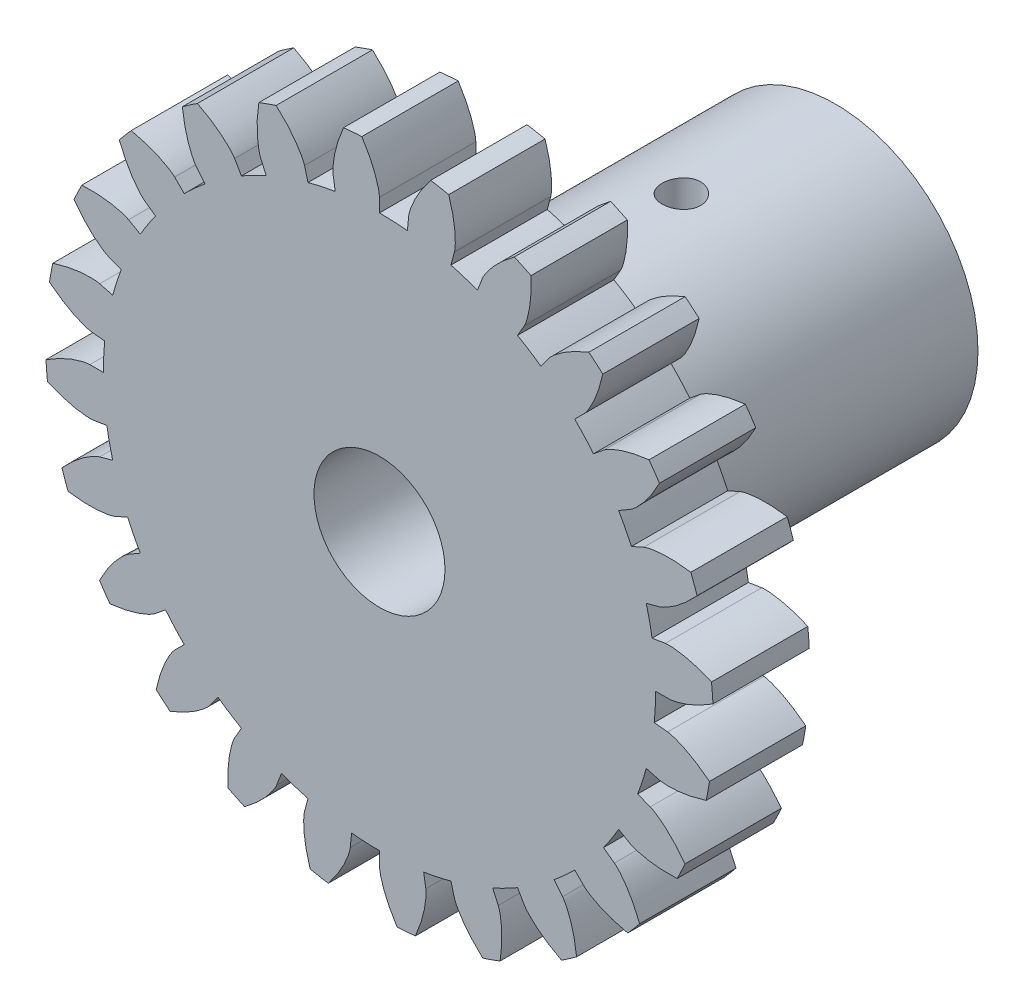
from build123d import *

# Parameters (mm, degrees)
SKETCH_3_R               = 26
EXTRUDE_2_DEPTH          = 7.5
CUT_EXTRUDE_2_DEPTH      = 38.526657192
PATTERN_CIRCULAR_1_COUNT = 24
MIRROR_1_COPY_1_DEPTH    = 38.526657192
MIRROR_1_COPY_2_DEPTH    = 38.526657192
MIRROR_1_COPY_3_DEPTH    = 38.526657192
MIRROR_1_COPY_4_DEPTH    = 38.526657192
MIRROR_1_COPY_5_DEPTH    = 38.526657192
MIRROR_1_COPY_6_DEPTH    = 38.526657192
MIRROR_1_COPY_7_DEPTH    = 38.526657192
MIRROR_1_COPY_8_DEPTH    = 38.526657192
MIRROR_1_COPY_9_DEPTH    = 38.526657192
MIRROR_1_COPY_10_DEPTH   = 38.526657192
MIRROR_1_COPY_11_DEPTH   = 38.526657192
MIRROR_1_COPY_12_DEPTH   = 38.526657192
MIRROR_1_COPY_13_DEPTH   = 38.526657192
MIRROR_1_COPY_14_DEPTH   = 38.526657192
MIRROR_1_COPY_15_DEPTH   = 38.526657192
MIRROR_1_COPY_16_DEPTH   = 38.526657192
MIRROR_1_COPY_17_DEPTH   = 38.526657192
MIRROR_1_COPY_18_DEPTH   = 38.526657192
MIRROR_1_COPY_19_DEPTH   = 38.526657192
MIRROR_1_COPY_20_DEPTH   = 38.526657192
MIRROR_1_COPY_21_DEPTH   = 38.526657192
MIRROR_1_COPY_22_DEPTH   = 38.526657192
MIRROR_1_COPY_23_DEPTH   = 38.526657192
SKETCH_5_R               = 5.1
CUT_EXTRUDE_3_DEPTH      = 38.476388038
SKETCH_7_R               = 11.1
SKETCH_7_R_2             = 5.1
EXTRUDE_3_DEPTH          = 28
CUT_EXTRUDE_4_DEPTH      = 47.176072363
CUT_EXTRUDE_4_DEPTH_BACK = 47.176072363
SKETCH_8_R               = 1.5


with BuildPart() as part:
    # ｽｹｯﾁ3 → ﾎﾞｽ - 押し出し2 (new body)
    with BuildSketch(Plane.XY):
        Circle(SKETCH_3_R)
    extrude(amount=EXTRUDE_2_DEPTH)

    # ｽｹｯﾁ4 → ｶｯﾄ - 押し出し2 (cut, through all)
    with BuildSketch(Plane.XY):
        with BuildLine():
            Line((21.472541613, -1.086258116), (25.966794508, -1.313614466))
            ThreePointArc((25.966794508, -1.313614466), (25.99998299, 0.029741003), (25.963721309, 1.373017029))
            add(Edge.make_bspline(
                [(22.552622899, 0), (22.58737922, 0.001108669), (22.656749084, 0.005403897), (22.850516265, 0.028314483), (23.215577821, 0.099947013), (23.763996392, 0.257632086), (24.493326716, 0.545763948), (25.148201555, 0.876714847), (25.627692166, 1.158881091), (25.900535651, 1.332190349), (25.963721309, 1.373017029)],
                knots=[0, 0, 0, 0, 0, 0.002802036, 0.005604071, 0.015718253, 0.029959921, 0.048733673, 0.068727069, 0.074791923, 0.074791923, 0.074791923, 0.074791923, 0.074791923], degree=4))
            Line((22.552622899, 0), (21.5, 0))
            ThreePointArc((21.5, 0), (21.493134307, -0.543302553), (21.472541613, -1.086258116))
        make_face()
    cut_extrude_2 = extrude(amount=CUT_EXTRUDE_2_DEPTH, mode=Mode.SUBTRACT)

    # 円形ﾊﾟﾀｰﾝ1: ｶｯﾄ - 押し出し2 ×24 about axis
    pattern_circular_1_axis = Axis((0, 0, 7.5), (0, 0, -1))
    for i in range(1, PATTERN_CIRCULAR_1_COUNT):
        add(cut_extrude_2.rotate(pattern_circular_1_axis, i * 360 / PATTERN_CIRCULAR_1_COUNT), mode=Mode.SUBTRACT)

    # ﾐﾗｰ1: ｶｯﾄ - 押し出し2 across plane
    add(cut_extrude_2.mirror(Plane(origin=(21.472541613, -1.086258116, 7.5), x_dir=(0, 0, 1), z_dir=(0.05052363332226129, 0.9987228657019513, 0))), mode=Mode.SUBTRACT)

    # ﾐﾗｰ1 copy 1 sketch → ﾐﾗｰ1 copy 1 (cut, through all)
    with BuildSketch(Plane(origin=(0, 0, 0), x_dir=(0.9871140654944314, 0.1600181917878578, 0), z_dir=(0, 0, 1))):
        with BuildLine():
            Line((21.472541613, 1.086258116), (25.966794508, 1.313614466))
            ThreePointArc((25.966794508, 1.313614466), (25.99998299, -0.029741003), (25.963721309, -1.373017029))
            add(Edge.make_bspline(
                [(22.552622899, 0), (22.58737922, -0.001108669), (22.656749084, -0.005403897), (22.850516265, -0.028314483), (23.215577821, -0.099947013), (23.763996392, -0.257632086), (24.493326716, -0.545763948), (25.148201555, -0.876714847), (25.627692166, -1.158881091), (25.900535651, -1.332190349), (25.963721309, -1.373017029)],
                knots=[0, 0, 0, 0, 0, 0.002802036, 0.005604071, 0.015718253, 0.029959921, 0.048733673, 0.068727069, 0.074791923, 0.074791923, 0.074791923, 0.074791923, 0.074791923], degree=4))
            Line((22.552622899, 0), (21.5, 0))
            ThreePointArc((21.5, 0), (21.493134307, 0.543302553), (21.472541613, 1.086258116))
        make_face()
    extrude(amount=MIRROR_1_COPY_1_DEPTH, mode=Mode.SUBTRACT)

    # ﾐﾗｰ1 copy 2 sketch → ﾐﾗｰ1 copy 2 (cut, through all)
    with BuildSketch(Plane(origin=(0, 0, 0), x_dir=(0.9120632137567047, 0.41004962396250505, 0), z_dir=(0, 0, 1))):
        with BuildLine():
            Line((21.472541613, 1.086258116), (25.966794508, 1.313614466))
            ThreePointArc((25.966794508, 1.313614466), (25.99998299, -0.029741003), (25.963721309, -1.373017029))
            add(Edge.make_bspline(
                [(22.552622899, 0), (22.58737922, -0.001108669), (22.656749084, -0.005403897), (22.850516265, -0.028314483), (23.215577821, -0.099947013), (23.763996392, -0.257632086), (24.493326716, -0.545763948), (25.148201555, -0.876714847), (25.627692166, -1.158881091), (25.900535651, -1.332190349), (25.963721309, -1.373017029)],
                knots=[0, 0, 0, 0, 0, 0.002802036, 0.005604071, 0.015718253, 0.029959921, 0.048733673, 0.068727069, 0.074791923, 0.074791923, 0.074791923, 0.074791923, 0.074791923], degree=4))
            Line((22.552622899, 0), (21.5, 0))
            ThreePointArc((21.5, 0), (21.493134307, 0.543302553), (21.472541613, 1.086258116))
        make_face()
    extrude(amount=MIRROR_1_COPY_2_DEPTH, mode=Mode.SUBTRACT)

    # ﾐﾗｰ1 copy 3 sketch → ﾐﾗｰ1 copy 3 (cut, through all)
    with BuildSketch(Plane(origin=(0, 0, 0), x_dir=(0.7748567612571848, 0.6321368519031512, 0), z_dir=(0, 0, 1))):
        with BuildLine():
            Line((21.472541613, 1.086258116), (25.966794508, 1.313614466))
            ThreePointArc((25.966794508, 1.313614466), (25.99998299, -0.029741003), (25.963721309, -1.373017029))
            add(Edge.make_bspline(
                [(22.552622899, 0), (22.58737922, -0.001108669), (22.656749084, -0.005403897), (22.850516265, -0.028314483), (23.215577821, -0.099947013), (23.763996392, -0.257632086), (24.493326716, -0.545763948), (25.148201555, -0.876714847), (25.627692166, -1.158881091), (25.900535651, -1.332190349), (25.963721309, -1.373017029)],
                knots=[0, 0, 0, 0, 0, 0.002802036, 0.005604071, 0.015718253, 0.029959921, 0.048733673, 0.068727069, 0.074791923, 0.074791923, 0.074791923, 0.074791923, 0.074791923], degree=4))
            Line((22.552622899, 0), (21.5, 0))
            ThreePointArc((21.5, 0), (21.493134307, 0.543302553), (21.472541613, 1.086258116))
        make_face()
    extrude(amount=MIRROR_1_COPY_3_DEPTH, mode=Mode.SUBTRACT)

    # ﾐﾗｰ1 copy 4 sketch → ﾐﾗｰ1 copy 4 (cut, through all)
    with BuildSketch(Plane(origin=(0, 0, 0), x_dir=(0.5848451009893306, 0.8111449980421381, 0), z_dir=(0, 0, 1))):
        with BuildLine():
            Line((21.472541613, 1.086258116), (25.966794508, 1.313614466))
            ThreePointArc((25.966794508, 1.313614466), (25.99998299, -0.029741003), (25.963721309, -1.373017029))
            add(Edge.make_bspline(
                [(22.552622899, 0), (22.58737922, -0.001108669), (22.656749084, -0.005403897), (22.850516265, -0.028314483), (23.215577821, -0.099947013), (23.763996392, -0.257632086), (24.493326716, -0.545763948), (25.148201555, -0.876714847), (25.627692166, -1.158881091), (25.900535651, -1.332190349), (25.963721309, -1.373017029)],
                knots=[0, 0, 0, 0, 0, 0.002802036, 0.005604071, 0.015718253, 0.029959921, 0.048733673, 0.068727069, 0.074791923, 0.074791923, 0.074791923, 0.074791923, 0.074791923], degree=4))
            Line((22.552622899, 0), (21.5, 0))
            ThreePointArc((21.5, 0), (21.493134307, 0.543302553), (21.472541613, 1.086258116))
        make_face()
    extrude(amount=MIRROR_1_COPY_4_DEPTH, mode=Mode.SUBTRACT)

    # ﾐﾗｰ1 copy 5 sketch → ﾐﾗｰ1 copy 5 (cut, through all)
    with BuildSketch(Plane(origin=(0, 0, 0), x_dir=(0.3549772135912804, 0.934874953045043, 0), z_dir=(0, 0, 1))):
        with BuildLine():
            Line((21.472541613, 1.086258116), (25.966794508, 1.313614466))
            ThreePointArc((25.966794508, 1.313614466), (25.99998299, -0.029741003), (25.963721309, -1.373017029))
            add(Edge.make_bspline(
                [(22.552622899, 0), (22.58737922, -0.001108669), (22.656749084, -0.005403897), (22.850516265, -0.028314483), (23.215577821, -0.099947013), (23.763996392, -0.257632086), (24.493326716, -0.545763948), (25.148201555, -0.876714847), (25.627692166, -1.158881091), (25.900535651, -1.332190349), (25.963721309, -1.373017029)],
                knots=[0, 0, 0, 0, 0, 0.002802036, 0.005604071, 0.015718253, 0.029959921, 0.048733673, 0.068727069, 0.074791923, 0.074791923, 0.074791923, 0.074791923, 0.074791923], degree=4))
            Line((22.552622899, 0), (21.5, 0))
            ThreePointArc((21.5, 0), (21.493134307, 0.543302553), (21.472541613, 1.086258116))
        make_face()
    extrude(amount=MIRROR_1_COPY_5_DEPTH, mode=Mode.SUBTRACT)

    # ﾐﾗｰ1 copy 6 sketch → ﾐﾗｰ1 copy 6 (cut, through all)
    with BuildSketch(Plane(origin=(0, 0, 0), x_dir=(0.10091821571456686, 0.9948947249518358, 0), z_dir=(0, 0, 1))):
        with BuildLine():
            Line((21.472541613, 1.086258116), (25.966794508, 1.313614466))
            ThreePointArc((25.966794508, 1.313614466), (25.99998299, -0.029741003), (25.963721309, -1.373017029))
            add(Edge.make_bspline(
                [(22.552622899, 0), (22.58737922, -0.001108669), (22.656749084, -0.005403897), (22.850516265, -0.028314483), (23.215577821, -0.099947013), (23.763996392, -0.257632086), (24.493326716, -0.545763948), (25.148201555, -0.876714847), (25.627692166, -1.158881091), (25.900535651, -1.332190349), (25.963721309, -1.373017029)],
                knots=[0, 0, 0, 0, 0, 0.002802036, 0.005604071, 0.015718253, 0.029959921, 0.048733673, 0.068727069, 0.074791923, 0.074791923, 0.074791923, 0.074791923, 0.074791923], degree=4))
            Line((22.552622899, 0), (21.5, 0))
            ThreePointArc((21.5, 0), (21.493134307, 0.543302553), (21.472541613, 1.086258116))
        make_face()
    extrude(amount=MIRROR_1_COPY_6_DEPTH, mode=Mode.SUBTRACT)

    # ﾐﾗｰ1 copy 7 sketch → ﾐﾗｰ1 copy 7 (cut, through all)
    with BuildSketch(Plane(origin=(0, 0, 0), x_dir=(-0.1600181917878578, 0.9871140654944318, 0), z_dir=(0, 0, 1))):
        with BuildLine():
            Line((21.472541613, 1.086258116), (25.966794508, 1.313614466))
            ThreePointArc((25.966794508, 1.313614466), (25.99998299, -0.029741003), (25.963721309, -1.373017029))
            add(Edge.make_bspline(
                [(22.552622899, 0), (22.58737922, -0.001108669), (22.656749084, -0.005403897), (22.850516265, -0.028314483), (23.215577821, -0.099947013), (23.763996392, -0.257632086), (24.493326716, -0.545763948), (25.148201555, -0.876714847), (25.627692166, -1.158881091), (25.900535651, -1.332190349), (25.963721309, -1.373017029)],
                knots=[0, 0, 0, 0, 0, 0.002802036, 0.005604071, 0.015718253, 0.029959921, 0.048733673, 0.068727069, 0.074791923, 0.074791923, 0.074791923, 0.074791923, 0.074791923], degree=4))
            Line((22.552622899, 0), (21.5, 0))
            ThreePointArc((21.5, 0), (21.493134307, 0.543302553), (21.472541613, 1.086258116))
        make_face()
    extrude(amount=MIRROR_1_COPY_7_DEPTH, mode=Mode.SUBTRACT)

    # ﾐﾗｰ1 copy 8 sketch → ﾐﾗｰ1 copy 8 (cut, through all)
    with BuildSketch(Plane(origin=(0, 0, 0), x_dir=(-0.41004962396250466, 0.9120632137567051, 0), z_dir=(0, 0, 1))):
        with BuildLine():
            Line((21.472541613, 1.086258116), (25.966794508, 1.313614466))
            ThreePointArc((25.966794508, 1.313614466), (25.99998299, -0.029741003), (25.963721309, -1.373017029))
            add(Edge.make_bspline(
                [(22.552622899, 0), (22.58737922, -0.001108669), (22.656749084, -0.005403897), (22.850516265, -0.028314483), (23.215577821, -0.099947013), (23.763996392, -0.257632086), (24.493326716, -0.545763948), (25.148201555, -0.876714847), (25.627692166, -1.158881091), (25.900535651, -1.332190349), (25.963721309, -1.373017029)],
                knots=[0, 0, 0, 0, 0, 0.002802036, 0.005604071, 0.015718253, 0.029959921, 0.048733673, 0.068727069, 0.074791923, 0.074791923, 0.074791923, 0.074791923, 0.074791923], degree=4))
            Line((22.552622899, 0), (21.5, 0))
            ThreePointArc((21.5, 0), (21.493134307, 0.543302553), (21.472541613, 1.086258116))
        make_face()
    extrude(amount=MIRROR_1_COPY_8_DEPTH, mode=Mode.SUBTRACT)

    # ﾐﾗｰ1 copy 9 sketch → ﾐﾗｰ1 copy 9 (cut, through all)
    with BuildSketch(Plane(origin=(0, 0, 0), x_dir=(-0.6321368519031508, 0.7748567612571852, 0), z_dir=(0, 0, 1))):
        with BuildLine():
            Line((21.472541613, 1.086258116), (25.966794508, 1.313614466))
            ThreePointArc((25.966794508, 1.313614466), (25.99998299, -0.029741003), (25.963721309, -1.373017029))
            add(Edge.make_bspline(
                [(22.552622899, 0), (22.58737922, -0.001108669), (22.656749084, -0.005403897), (22.850516265, -0.028314483), (23.215577821, -0.099947013), (23.763996392, -0.257632086), (24.493326716, -0.545763948), (25.148201555, -0.876714847), (25.627692166, -1.158881091), (25.900535651, -1.332190349), (25.963721309, -1.373017029)],
                knots=[0, 0, 0, 0, 0, 0.002802036, 0.005604071, 0.015718253, 0.029959921, 0.048733673, 0.068727069, 0.074791923, 0.074791923, 0.074791923, 0.074791923, 0.074791923], degree=4))
            Line((22.552622899, 0), (21.5, 0))
            ThreePointArc((21.5, 0), (21.493134307, 0.543302553), (21.472541613, 1.086258116))
        make_face()
    extrude(amount=MIRROR_1_COPY_9_DEPTH, mode=Mode.SUBTRACT)

    # ﾐﾗｰ1 copy 10 sketch → ﾐﾗｰ1 copy 10 (cut, through all)
    with BuildSketch(Plane(origin=(0, 0, 0), x_dir=(-0.811144998042138, 0.5848451009893306, 0), z_dir=(0, 0, 1))):
        with BuildLine():
            Line((21.472541613, 1.086258116), (25.966794508, 1.313614466))
            ThreePointArc((25.966794508, 1.313614466), (25.99998299, -0.029741003), (25.963721309, -1.373017029))
            add(Edge.make_bspline(
                [(22.552622899, 0), (22.58737922, -0.001108669), (22.656749084, -0.005403897), (22.850516265, -0.028314483), (23.215577821, -0.099947013), (23.763996392, -0.257632086), (24.493326716, -0.545763948), (25.148201555, -0.876714847), (25.627692166, -1.158881091), (25.900535651, -1.332190349), (25.963721309, -1.373017029)],
                knots=[0, 0, 0, 0, 0, 0.002802036, 0.005604071, 0.015718253, 0.029959921, 0.048733673, 0.068727069, 0.074791923, 0.074791923, 0.074791923, 0.074791923, 0.074791923], degree=4))
            Line((22.552622899, 0), (21.5, 0))
            ThreePointArc((21.5, 0), (21.493134307, 0.543302553), (21.472541613, 1.086258116))
        make_face()
    extrude(amount=MIRROR_1_COPY_10_DEPTH, mode=Mode.SUBTRACT)

    # ﾐﾗｰ1 copy 11 sketch → ﾐﾗｰ1 copy 11 (cut, through all)
    with BuildSketch(Plane(origin=(0, 0, 0), x_dir=(-0.9348749530450424, 0.3549772135912808, 0), z_dir=(0, 0, 1))):
        with BuildLine():
            Line((21.472541613, 1.086258116), (25.966794508, 1.313614466))
            ThreePointArc((25.966794508, 1.313614466), (25.99998299, -0.029741003), (25.963721309, -1.373017029))
            add(Edge.make_bspline(
                [(22.552622899, 0), (22.58737922, -0.001108669), (22.656749084, -0.005403897), (22.850516265, -0.028314483), (23.215577821, -0.099947013), (23.763996392, -0.257632086), (24.493326716, -0.545763948), (25.148201555, -0.876714847), (25.627692166, -1.158881091), (25.900535651, -1.332190349), (25.963721309, -1.373017029)],
                knots=[0, 0, 0, 0, 0, 0.002802036, 0.005604071, 0.015718253, 0.029959921, 0.048733673, 0.068727069, 0.074791923, 0.074791923, 0.074791923, 0.074791923, 0.074791923], degree=4))
            Line((22.552622899, 0), (21.5, 0))
            ThreePointArc((21.5, 0), (21.493134307, 0.543302553), (21.472541613, 1.086258116))
        make_face()
    extrude(amount=MIRROR_1_COPY_11_DEPTH, mode=Mode.SUBTRACT)

    # ﾐﾗｰ1 copy 12 sketch → ﾐﾗｰ1 copy 12 (cut, through all)
    with BuildSketch(Plane(origin=(0, 0, 0), x_dir=(-0.9948947249518354, 0.10091821571456693, 0), z_dir=(0, 0, 1))):
        with BuildLine():
            Line((21.472541613, 1.086258116), (25.966794508, 1.313614466))
            ThreePointArc((25.966794508, 1.313614466), (25.99998299, -0.029741003), (25.963721309, -1.373017029))
            add(Edge.make_bspline(
                [(22.552622899, 0), (22.58737922, -0.001108669), (22.656749084, -0.005403897), (22.850516265, -0.028314483), (23.215577821, -0.099947013), (23.763996392, -0.257632086), (24.493326716, -0.545763948), (25.148201555, -0.876714847), (25.627692166, -1.158881091), (25.900535651, -1.332190349), (25.963721309, -1.373017029)],
                knots=[0, 0, 0, 0, 0, 0.002802036, 0.005604071, 0.015718253, 0.029959921, 0.048733673, 0.068727069, 0.074791923, 0.074791923, 0.074791923, 0.074791923, 0.074791923], degree=4))
            Line((22.552622899, 0), (21.5, 0))
            ThreePointArc((21.5, 0), (21.493134307, 0.543302553), (21.472541613, 1.086258116))
        make_face()
    extrude(amount=MIRROR_1_COPY_12_DEPTH, mode=Mode.SUBTRACT)

    # ﾐﾗｰ1 copy 13 sketch → ﾐﾗｰ1 copy 13 (cut, through all)
    with BuildSketch(Plane(origin=(0, 0, 0), x_dir=(-0.9871140654944314, -0.16001819178785787, 0), z_dir=(0, 0, 1))):
        with BuildLine():
            Line((21.472541613, 1.086258116), (25.966794508, 1.313614466))
            ThreePointArc((25.966794508, 1.313614466), (25.99998299, -0.029741003), (25.963721309, -1.373017029))
            add(Edge.make_bspline(
                [(22.552622899, 0), (22.58737922, -0.001108669), (22.656749084, -0.005403897), (22.850516265, -0.028314483), (23.215577821, -0.099947013), (23.763996392, -0.257632086), (24.493326716, -0.545763948), (25.148201555, -0.876714847), (25.627692166, -1.158881091), (25.900535651, -1.332190349), (25.963721309, -1.373017029)],
                knots=[0, 0, 0, 0, 0, 0.002802036, 0.005604071, 0.015718253, 0.029959921, 0.048733673, 0.068727069, 0.074791923, 0.074791923, 0.074791923, 0.074791923, 0.074791923], degree=4))
            Line((22.552622899, 0), (21.5, 0))
            ThreePointArc((21.5, 0), (21.493134307, 0.543302553), (21.472541613, 1.086258116))
        make_face()
    extrude(amount=MIRROR_1_COPY_13_DEPTH, mode=Mode.SUBTRACT)

    # ﾐﾗｰ1 copy 14 sketch → ﾐﾗｰ1 copy 14 (cut, through all)
    with BuildSketch(Plane(origin=(0, 0, 0), x_dir=(-0.9120632137567046, -0.4100496239625052, 0), z_dir=(0, 0, 1))):
        with BuildLine():
            Line((21.472541613, 1.086258116), (25.966794508, 1.313614466))
            ThreePointArc((25.966794508, 1.313614466), (25.99998299, -0.029741003), (25.963721309, -1.373017029))
            add(Edge.make_bspline(
                [(22.552622899, 0), (22.58737922, -0.001108669), (22.656749084, -0.005403897), (22.850516265, -0.028314483), (23.215577821, -0.099947013), (23.763996392, -0.257632086), (24.493326716, -0.545763948), (25.148201555, -0.876714847), (25.627692166, -1.158881091), (25.900535651, -1.332190349), (25.963721309, -1.373017029)],
                knots=[0, 0, 0, 0, 0, 0.002802036, 0.005604071, 0.015718253, 0.029959921, 0.048733673, 0.068727069, 0.074791923, 0.074791923, 0.074791923, 0.074791923, 0.074791923], degree=4))
            Line((22.552622899, 0), (21.5, 0))
            ThreePointArc((21.5, 0), (21.493134307, 0.543302553), (21.472541613, 1.086258116))
        make_face()
    extrude(amount=MIRROR_1_COPY_14_DEPTH, mode=Mode.SUBTRACT)

    # ﾐﾗｰ1 copy 15 sketch → ﾐﾗｰ1 copy 15 (cut, through all)
    with BuildSketch(Plane(origin=(0, 0, 0), x_dir=(-0.774856761257185, -0.6321368519031512, 0), z_dir=(0, 0, 1))):
        with BuildLine():
            Line((21.472541613, 1.086258116), (25.966794508, 1.313614466))
            ThreePointArc((25.966794508, 1.313614466), (25.99998299, -0.029741003), (25.963721309, -1.373017029))
            add(Edge.make_bspline(
                [(22.552622899, 0), (22.58737922, -0.001108669), (22.656749084, -0.005403897), (22.850516265, -0.028314483), (23.215577821, -0.099947013), (23.763996392, -0.257632086), (24.493326716, -0.545763948), (25.148201555, -0.876714847), (25.627692166, -1.158881091), (25.900535651, -1.332190349), (25.963721309, -1.373017029)],
                knots=[0, 0, 0, 0, 0, 0.002802036, 0.005604071, 0.015718253, 0.029959921, 0.048733673, 0.068727069, 0.074791923, 0.074791923, 0.074791923, 0.074791923, 0.074791923], degree=4))
            Line((22.552622899, 0), (21.5, 0))
            ThreePointArc((21.5, 0), (21.493134307, 0.543302553), (21.472541613, 1.086258116))
        make_face()
    extrude(amount=MIRROR_1_COPY_15_DEPTH, mode=Mode.SUBTRACT)

    # ﾐﾗｰ1 copy 16 sketch → ﾐﾗｰ1 copy 16 (cut, through all)
    with BuildSketch(Plane(origin=(0, 0, 0), x_dir=(-0.584845100989331, -0.8111449980421379, 0), z_dir=(0, 0, 1))):
        with BuildLine():
            Line((21.472541613, 1.086258116), (25.966794508, 1.313614466))
            ThreePointArc((25.966794508, 1.313614466), (25.99998299, -0.029741003), (25.963721309, -1.373017029))
            add(Edge.make_bspline(
                [(22.552622899, 0), (22.58737922, -0.001108669), (22.656749084, -0.005403897), (22.850516265, -0.028314483), (23.215577821, -0.099947013), (23.763996392, -0.257632086), (24.493326716, -0.545763948), (25.148201555, -0.876714847), (25.627692166, -1.158881091), (25.900535651, -1.332190349), (25.963721309, -1.373017029)],
                knots=[0, 0, 0, 0, 0, 0.002802036, 0.005604071, 0.015718253, 0.029959921, 0.048733673, 0.068727069, 0.074791923, 0.074791923, 0.074791923, 0.074791923, 0.074791923], degree=4))
            Line((22.552622899, 0), (21.5, 0))
            ThreePointArc((21.5, 0), (21.493134307, 0.543302553), (21.472541613, 1.086258116))
        make_face()
    extrude(amount=MIRROR_1_COPY_16_DEPTH, mode=Mode.SUBTRACT)

    # ﾐﾗｰ1 copy 17 sketch → ﾐﾗｰ1 copy 17 (cut, through all)
    with BuildSketch(Plane(origin=(0, 0, 0), x_dir=(-0.3549772135912803, -0.934874953045043, 0), z_dir=(0, 0, 1))):
        with BuildLine():
            Line((21.472541613, 1.086258116), (25.966794508, 1.313614466))
            ThreePointArc((25.966794508, 1.313614466), (25.99998299, -0.029741003), (25.963721309, -1.373017029))
            add(Edge.make_bspline(
                [(22.552622899, 0), (22.58737922, -0.001108669), (22.656749084, -0.005403897), (22.850516265, -0.028314483), (23.215577821, -0.099947013), (23.763996392, -0.257632086), (24.493326716, -0.545763948), (25.148201555, -0.876714847), (25.627692166, -1.158881091), (25.900535651, -1.332190349), (25.963721309, -1.373017029)],
                knots=[0, 0, 0, 0, 0, 0.002802036, 0.005604071, 0.015718253, 0.029959921, 0.048733673, 0.068727069, 0.074791923, 0.074791923, 0.074791923, 0.074791923, 0.074791923], degree=4))
            Line((22.552622899, 0), (21.5, 0))
            ThreePointArc((21.5, 0), (21.493134307, 0.543302553), (21.472541613, 1.086258116))
        make_face()
    extrude(amount=MIRROR_1_COPY_17_DEPTH, mode=Mode.SUBTRACT)

    # ﾐﾗｰ1 copy 18 sketch → ﾐﾗｰ1 copy 18 (cut, through all)
    with BuildSketch(Plane(origin=(0, 0, 0), x_dir=(-0.10091821571456698, -0.9948947249518358, 0), z_dir=(0, 0, 1))):
        with BuildLine():
            Line((21.472541613, 1.086258116), (25.966794508, 1.313614466))
            ThreePointArc((25.966794508, 1.313614466), (25.99998299, -0.029741003), (25.963721309, -1.373017029))
            add(Edge.make_bspline(
                [(22.552622899, 0), (22.58737922, -0.001108669), (22.656749084, -0.005403897), (22.850516265, -0.028314483), (23.215577821, -0.099947013), (23.763996392, -0.257632086), (24.493326716, -0.545763948), (25.148201555, -0.876714847), (25.627692166, -1.158881091), (25.900535651, -1.332190349), (25.963721309, -1.373017029)],
                knots=[0, 0, 0, 0, 0, 0.002802036, 0.005604071, 0.015718253, 0.029959921, 0.048733673, 0.068727069, 0.074791923, 0.074791923, 0.074791923, 0.074791923, 0.074791923], degree=4))
            Line((22.552622899, 0), (21.5, 0))
            ThreePointArc((21.5, 0), (21.493134307, 0.543302553), (21.472541613, 1.086258116))
        make_face()
    extrude(amount=MIRROR_1_COPY_18_DEPTH, mode=Mode.SUBTRACT)

    # ﾐﾗｰ1 copy 19 sketch → ﾐﾗｰ1 copy 19 (cut, through all)
    with BuildSketch(Plane(origin=(0, 0, 0), x_dir=(0.16001819178785723, -0.9871140654944318, 0), z_dir=(0, 0, 1))):
        with BuildLine():
            Line((21.472541613, 1.086258116), (25.966794508, 1.313614466))
            ThreePointArc((25.966794508, 1.313614466), (25.99998299, -0.029741003), (25.963721309, -1.373017029))
            add(Edge.make_bspline(
                [(22.552622899, 0), (22.58737922, -0.001108669), (22.656749084, -0.005403897), (22.850516265, -0.028314483), (23.215577821, -0.099947013), (23.763996392, -0.257632086), (24.493326716, -0.545763948), (25.148201555, -0.876714847), (25.627692166, -1.158881091), (25.900535651, -1.332190349), (25.963721309, -1.373017029)],
                knots=[0, 0, 0, 0, 0, 0.002802036, 0.005604071, 0.015718253, 0.029959921, 0.048733673, 0.068727069, 0.074791923, 0.074791923, 0.074791923, 0.074791923, 0.074791923], degree=4))
            Line((22.552622899, 0), (21.5, 0))
            ThreePointArc((21.5, 0), (21.493134307, 0.543302553), (21.472541613, 1.086258116))
        make_face()
    extrude(amount=MIRROR_1_COPY_19_DEPTH, mode=Mode.SUBTRACT)

    # ﾐﾗｰ1 copy 20 sketch → ﾐﾗｰ1 copy 20 (cut, through all)
    with BuildSketch(Plane(origin=(0, 0, 0), x_dir=(0.410049623962505, -0.9120632137567051, 0), z_dir=(0, 0, 1))):
        with BuildLine():
            Line((21.472541613, 1.086258116), (25.966794508, 1.313614466))
            ThreePointArc((25.966794508, 1.313614466), (25.99998299, -0.029741003), (25.963721309, -1.373017029))
            add(Edge.make_bspline(
                [(22.552622899, 0), (22.58737922, -0.001108669), (22.656749084, -0.005403897), (22.850516265, -0.028314483), (23.215577821, -0.099947013), (23.763996392, -0.257632086), (24.493326716, -0.545763948), (25.148201555, -0.876714847), (25.627692166, -1.158881091), (25.900535651, -1.332190349), (25.963721309, -1.373017029)],
                knots=[0, 0, 0, 0, 0, 0.002802036, 0.005604071, 0.015718253, 0.029959921, 0.048733673, 0.068727069, 0.074791923, 0.074791923, 0.074791923, 0.074791923, 0.074791923], degree=4))
            Line((22.552622899, 0), (21.5, 0))
            ThreePointArc((21.5, 0), (21.493134307, 0.543302553), (21.472541613, 1.086258116))
        make_face()
    extrude(amount=MIRROR_1_COPY_20_DEPTH, mode=Mode.SUBTRACT)

    # ﾐﾗｰ1 copy 21 sketch → ﾐﾗｰ1 copy 21 (cut, through all)
    with BuildSketch(Plane(origin=(0, 0, 0), x_dir=(0.6321368519031507, -0.7748567612571853, 0), z_dir=(0, 0, 1))):
        with BuildLine():
            Line((21.472541613, 1.086258116), (25.966794508, 1.313614466))
            ThreePointArc((25.966794508, 1.313614466), (25.99998299, -0.029741003), (25.963721309, -1.373017029))
            add(Edge.make_bspline(
                [(22.552622899, 0), (22.58737922, -0.001108669), (22.656749084, -0.005403897), (22.850516265, -0.028314483), (23.215577821, -0.099947013), (23.763996392, -0.257632086), (24.493326716, -0.545763948), (25.148201555, -0.876714847), (25.627692166, -1.158881091), (25.900535651, -1.332190349), (25.963721309, -1.373017029)],
                knots=[0, 0, 0, 0, 0, 0.002802036, 0.005604071, 0.015718253, 0.029959921, 0.048733673, 0.068727069, 0.074791923, 0.074791923, 0.074791923, 0.074791923, 0.074791923], degree=4))
            Line((22.552622899, 0), (21.5, 0))
            ThreePointArc((21.5, 0), (21.493134307, 0.543302553), (21.472541613, 1.086258116))
        make_face()
    extrude(amount=MIRROR_1_COPY_21_DEPTH, mode=Mode.SUBTRACT)

    # ﾐﾗｰ1 copy 22 sketch → ﾐﾗｰ1 copy 22 (cut, through all)
    with BuildSketch(Plane(origin=(0, 0, 0), x_dir=(0.8111449980421376, -0.5848451009893312, 0), z_dir=(0, 0, 1))):
        with BuildLine():
            Line((21.472541613, 1.086258116), (25.966794508, 1.313614466))
            ThreePointArc((25.966794508, 1.313614466), (25.99998299, -0.029741003), (25.963721309, -1.373017029))
            add(Edge.make_bspline(
                [(22.552622899, 0), (22.58737922, -0.001108669), (22.656749084, -0.005403897), (22.850516265, -0.028314483), (23.215577821, -0.099947013), (23.763996392, -0.257632086), (24.493326716, -0.545763948), (25.148201555, -0.876714847), (25.627692166, -1.158881091), (25.900535651, -1.332190349), (25.963721309, -1.373017029)],
                knots=[0, 0, 0, 0, 0, 0.002802036, 0.005604071, 0.015718253, 0.029959921, 0.048733673, 0.068727069, 0.074791923, 0.074791923, 0.074791923, 0.074791923, 0.074791923], degree=4))
            Line((22.552622899, 0), (21.5, 0))
            ThreePointArc((21.5, 0), (21.493134307, 0.543302553), (21.472541613, 1.086258116))
        make_face()
    extrude(amount=MIRROR_1_COPY_22_DEPTH, mode=Mode.SUBTRACT)

    # ﾐﾗｰ1 copy 23 sketch → ﾐﾗｰ1 copy 23 (cut, through all)
    with BuildSketch(Plane(origin=(0, 0, 0), x_dir=(0.9348749530450425, -0.3549772135912805, 0), z_dir=(0, 0, 1))):
        with BuildLine():
            Line((21.472541613, 1.086258116), (25.966794508, 1.313614466))
            ThreePointArc((25.966794508, 1.313614466), (25.99998299, -0.029741003), (25.963721309, -1.373017029))
            add(Edge.make_bspline(
                [(22.552622899, 0), (22.58737922, -0.001108669), (22.656749084, -0.005403897), (22.850516265, -0.028314483), (23.215577821, -0.099947013), (23.763996392, -0.257632086), (24.493326716, -0.545763948), (25.148201555, -0.876714847), (25.627692166, -1.158881091), (25.900535651, -1.332190349), (25.963721309, -1.373017029)],
                knots=[0, 0, 0, 0, 0, 0.002802036, 0.005604071, 0.015718253, 0.029959921, 0.048733673, 0.068727069, 0.074791923, 0.074791923, 0.074791923, 0.074791923, 0.074791923], degree=4))
            Line((22.552622899, 0), (21.5, 0))
            ThreePointArc((21.5, 0), (21.493134307, 0.543302553), (21.472541613, 1.086258116))
        make_face()
    extrude(amount=MIRROR_1_COPY_23_DEPTH, mode=Mode.SUBTRACT)

    # ｽｹｯﾁ5 → ｶｯﾄ - 押し出し3 (cut, through all)
    with BuildSketch(Plane.XY.offset(7.5)):
        Circle(SKETCH_5_R)
    extrude(amount=-CUT_EXTRUDE_3_DEPTH, mode=Mode.SUBTRACT)

    # ｽｹｯﾁ7 → ﾎﾞｽ - 押し出し3 (add)
    with BuildSketch(Plane(origin=(0, 0, 0), x_dir=(-1, 0, 0), z_dir=(0, 0, -1))):
        with Locations(Location((0, 0, 0), (0, 0, 180))):
            Circle(SKETCH_7_R)
        with Locations(Location((0, 0, 0), (0, 0, 180))):
            Circle(SKETCH_7_R_2, mode=Mode.SUBTRACT)
    extrude(amount=EXTRUDE_3_DEPTH)

    # ｽｹｯﾁ8 → ｶｯﾄ - 押し出し4 (cut, two sides: drawn at the far end of the back side and taken through both)
    with BuildSketch(Plane(origin=(0, 0, 0), x_dir=(1, 0, 0), z_dir=(0, 1, 0)).offset(-CUT_EXTRUDE_4_DEPTH_BACK)):
        with Locations(Location((0, 16, 0), (0, 0, 270))):
            Circle(SKETCH_8_R)
    extrude(amount=CUT_EXTRUDE_4_DEPTH + CUT_EXTRUDE_4_DEPTH_BACK, mode=Mode.SUBTRACT)


solid = part.part
